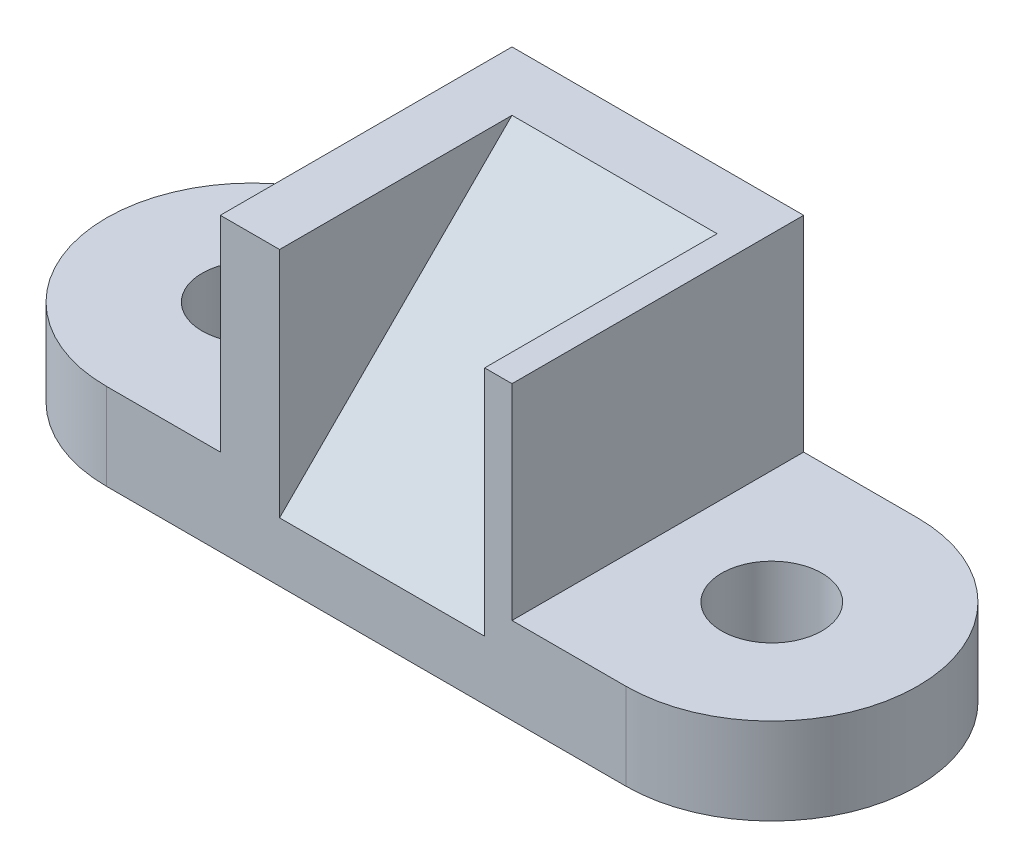
from build123d import *

# Parameters (mm, degrees)
SKETCH1_R           = 11
BOSS_EXTRUDE1_DEPTH = 19
SKETCH2_W           = 64
SKETCH2_H           = 64
BOSS_EXTRUDE2_DEPTH = 45
CUT_EXTRUDE2_START  = -13
CUT_EXTRUDE2_DEPTH  = 45


with BuildPart() as part:
    # Sketch1 → Boss-Extrude1 (new body)
    with BuildSketch(Plane(origin=(0, 0, 0), x_dir=(1, 0, 0), z_dir=(0, 1, 0))):
        with BuildLine():
            Line((0, 32), (114, 32))
            ThreePointArc((114, 32), (146, 0), (114, -32))
            Line((114, -32), (0, -32))
            ThreePointArc((0, -32), (-32, 0), (0, 32))
        make_face()
        with Locations(Location((0, 0, 0), (0, 0, 270))):
            Circle(SKETCH1_R, mode=Mode.SUBTRACT)
        with Locations(Location((114, 0, 0), (0, 0, 270))):
            Circle(SKETCH1_R, mode=Mode.SUBTRACT)
    extrude(amount=BOSS_EXTRUDE1_DEPTH)

    # Sketch2 → Boss-Extrude2 (add)
    with BuildSketch(Plane(origin=(0, 19, 0), x_dir=(1, 0, 0), z_dir=(0, 1, 0))):
        with Locations((57, 0)):
            Rectangle(SKETCH2_W, SKETCH2_H)
    extrude(amount=BOSS_EXTRUDE2_DEPTH)

    # Sketch3 → Cut-Extrude2 (cut)
    with BuildSketch(Plane.ZY.offset(-25).offset(CUT_EXTRUDE2_START)):
        Polygon((32, 64), (-19, 64), (32, 13), align=None)
    extrude(amount=-CUT_EXTRUDE2_DEPTH, mode=Mode.SUBTRACT)


solid = part.part
